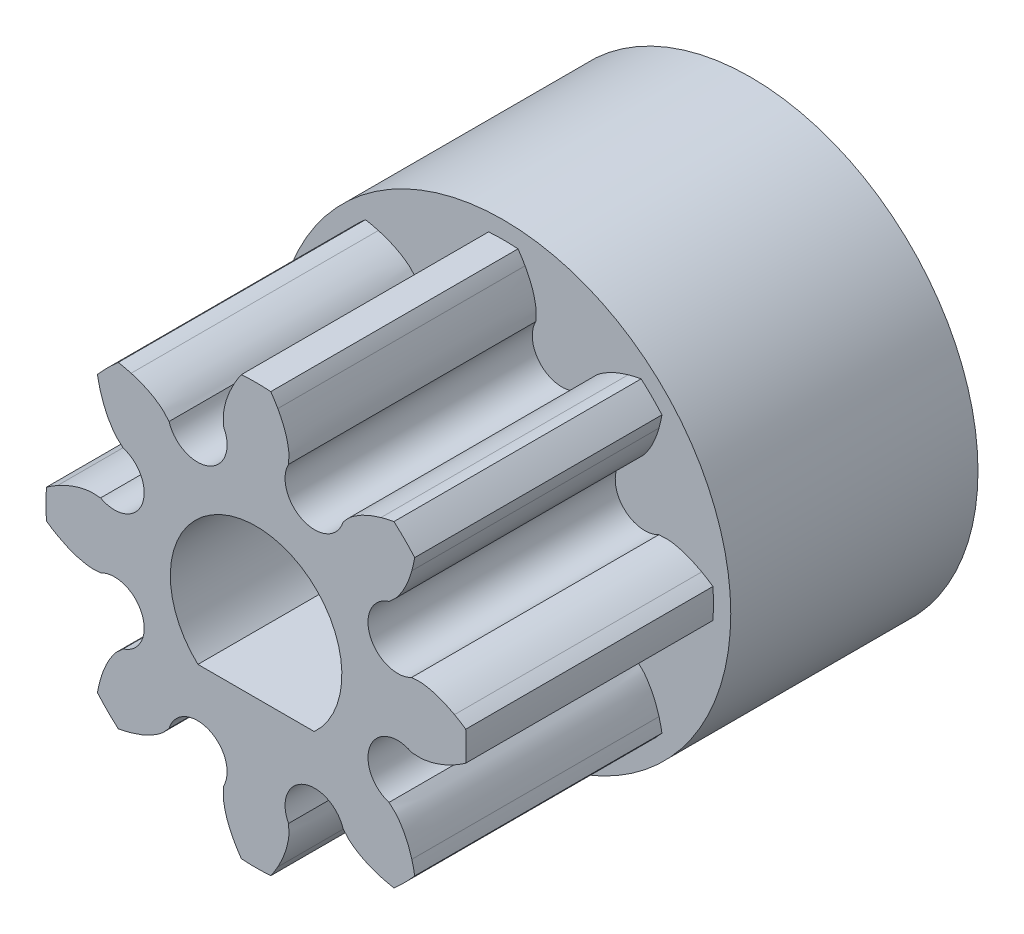
from build123d import *

# Parameters (mm, degrees)
SKETCH7_R           = 5.3975
BOSS_EXTRUDE2_DEPTH = 6.35
CUT_EXTRUDE2_DEPTH  = 7.62
CIRPATTERN2_COUNT   = 8
SKETCH10_R          = 5.842
BOSS_EXTRUDE3_DEPTH = 6.35
CUT_EXTRUDE3_DEPTH  = 427.514731358


with BuildPart() as part:
    # Sketch7 → Boss-Extrude2 (new body)
    with BuildSketch(Plane.XY):
        with Locations((395.233023525, 138.699867492)):
            Circle(SKETCH7_R)
    extrude(amount=BOSS_EXTRUDE2_DEPTH)

    # Sketch9 → Cut-Extrude2 (cut)
    with BuildSketch(Plane.XY.offset(6.35)):
        with BuildLine():
            ThreePointArc((396.066485134, 142.693996729), (396.447574214, 141.632052237), (397.467953038, 142.113489716))
            add(Edge.make_bspline(
                [(398.442060553, 142.699194872), (398.416870899, 142.692023163), (398.347249416, 142.671195841), (398.234475122, 142.632680926), (398.104825625, 142.581273279), (397.978393672, 142.522380536), (397.856225534, 142.454879645), (397.740116621, 142.377837061), (397.628299175, 142.293624418), (397.544582839, 142.198119959), (397.491567061, 142.137639013), (397.467953038, 142.113489716)],
                knots=[0, 0, 0, 0, 0.034205018, 0.094899146, 0.155592535, 0.216282339, 0.276969295, 0.337654221, 0.398329274, 0.458948073, 0.503107017, 0.503107017, 0.503107017, 0.503107017], degree=3))
            add(Edge.make_bspline(
                [(398.442060553, 142.699194872), (398.461568299, 142.704748894), (398.525962688, 142.722367138), (398.636126957, 142.748649627), (398.727406276, 142.766301453), (398.773201735, 142.774194982)],
                knots=[0, 0, 0, 0, 0.179128004, 0.589562423, 1, 1, 1, 1], degree=3))
            ThreePointArc((398.773201735, 142.774194982), (397.465514907, 144.089578464), (395.610724104, 144.084136107))
            add(Edge.make_bspline(
                [(395.610724104, 144.084136107), (395.637524816, 144.04617226), (395.689587316, 143.969146309), (395.748900691, 143.87266388), (395.78197642, 143.814672192), (395.791843192, 143.796950846)],
                knots=[0, 0, 0, 0, 0.410437577, 0.820871996, 1, 1, 1, 1], degree=3))
            add(Edge.make_bspline(
                [(396.066485134, 142.693996729), (396.06686363, 142.727770496), (396.072142301, 142.808024799), (396.080477763, 142.934753038), (396.06095822, 143.073367244), (396.033334154, 143.209945977), (395.994678573, 143.344062234), (395.946921139, 143.475106583), (395.891595796, 143.603133318), (395.839086486, 143.710110943), (395.804583803, 143.774067906), (395.791843192, 143.796950846)],
                knots=[0.496892983, 0.496892983, 0.496892983, 0.496892983, 0.541051927, 0.601670726, 0.662345779, 0.723030705, 0.783717661, 0.844407465, 0.905100854, 0.965794982, 1, 1, 1, 1], degree=3))
        make_face()
    cut_extrude2 = extrude(amount=-CUT_EXTRUDE2_DEPTH, mode=Mode.SUBTRACT)

    # CirPattern2: Cut-Extrude2 ×8 about axis
    cirpattern2_axis = Axis((395.233023525, 138.699867492, 6.35), (0, 0, -1))
    for i in range(1, CIRPATTERN2_COUNT):
        add(cut_extrude2.rotate(cirpattern2_axis, i * 360 / CIRPATTERN2_COUNT), mode=Mode.SUBTRACT)

    # Sketch10 → Boss-Extrude3 (add)
    with BuildSketch(Plane(origin=(0, 0, 0), x_dir=(-1, 0, 0), z_dir=(0, 0, -1))):
        with Locations((-395.233023525, 138.699867492)):
            Circle(SKETCH10_R)
    extrude(amount=BOSS_EXTRUDE3_DEPTH)

    # Sketch11 → Cut-Extrude3 (cut, through all)
    with BuildSketch(Plane(origin=(0, 0, -6.35), x_dir=(-1, 0, 0), z_dir=(0, 0, -1))):
        with BuildLine():
            Line((-396.72678053, 137.080367492), (-393.73926652, 137.080367492))
            ThreePointArc((-393.73926652, 137.080367492), (-395.233023525, 140.903067492), (-396.72678053, 137.080367492))
        make_face()
    extrude(amount=-CUT_EXTRUDE3_DEPTH, mode=Mode.SUBTRACT)


solid = part.part
